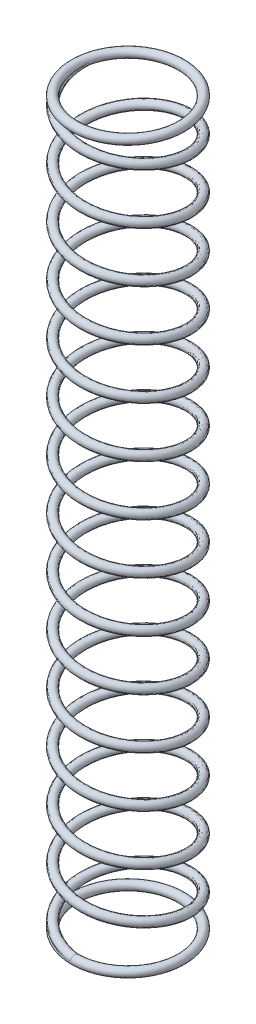
from build123d import *

# Parameters (mm, degrees)
BALAYAGE4_PROFILE_R = 0.3
BALAYAGE5_PITCH     = 3.5
BALAYAGE5_HEIGHT    = 50
BALAYAGE5_RADIUS    = 3.7
BALAYAGE5_PROFILE_R = 0.3
BALAYAGE8_PROFILE_R = 0.3


with BuildPart() as part:
    # Balayage4: sweep along a path in Esquisse16
    with BuildLine(Plane(origin=(0, 0, 0), x_dir=(1, 0, 0), z_dir=(0, 1, 0))) as balayage4_path:
        CenterArc((0, 0), 3.7, 0, 360)
    # Balayage4 profile (on start of the path) → Balayage4 (sweep)
    with BuildSketch(Plane(origin=(3.7, 0, 0), x_dir=(-1, 0, 0), z_dir=(0, 0, -1))):
        Circle(BALAYAGE4_PROFILE_R)
    sweep(path=balayage4_path.line)


with BuildPart() as body_2:
    # Balayage5: sweep along a helix
    with BuildLine() as balayage5_path:
        Helix(BALAYAGE5_PITCH, BALAYAGE5_HEIGHT, BALAYAGE5_RADIUS, center=(0, 0, 0), direction=(0, 1, 0), lefthand=True)
    # Balayage5 profile (on start of the path) → Balayage5 (sweep)
    with BuildSketch(Plane(origin=(0, 0, 3.7), x_dir=(-0.14887424264614876, -0.9888561370980795, 0), z_dir=(-0.9888561370980795, 0.14887424264614876, -1.7326186485383558e-13))):
        Circle(BALAYAGE5_PROFILE_R)
    sweep(path=balayage5_path.line, is_frenet=True)


with BuildPart() as body_3:
    # Balayage8: sweep along a path in Esquisse68
    with BuildLine(Plane(origin=(0, 50, 0), x_dir=(1, 0, 0), z_dir=(0, 1, 0))) as balayage8_path:
        CenterArc((0, 0), 3.7, 0, 360)
    # Balayage8 profile (on start of the path) → Balayage8 (sweep)
    with BuildSketch(Plane(origin=(3.7, 50, 0), x_dir=(-1, 0, 0), z_dir=(0, 0, -1))):
        Circle(BALAYAGE8_PROFILE_R)
    sweep(path=balayage8_path.line)


solid = Compound([part.part, body_2.part, body_3.part])
